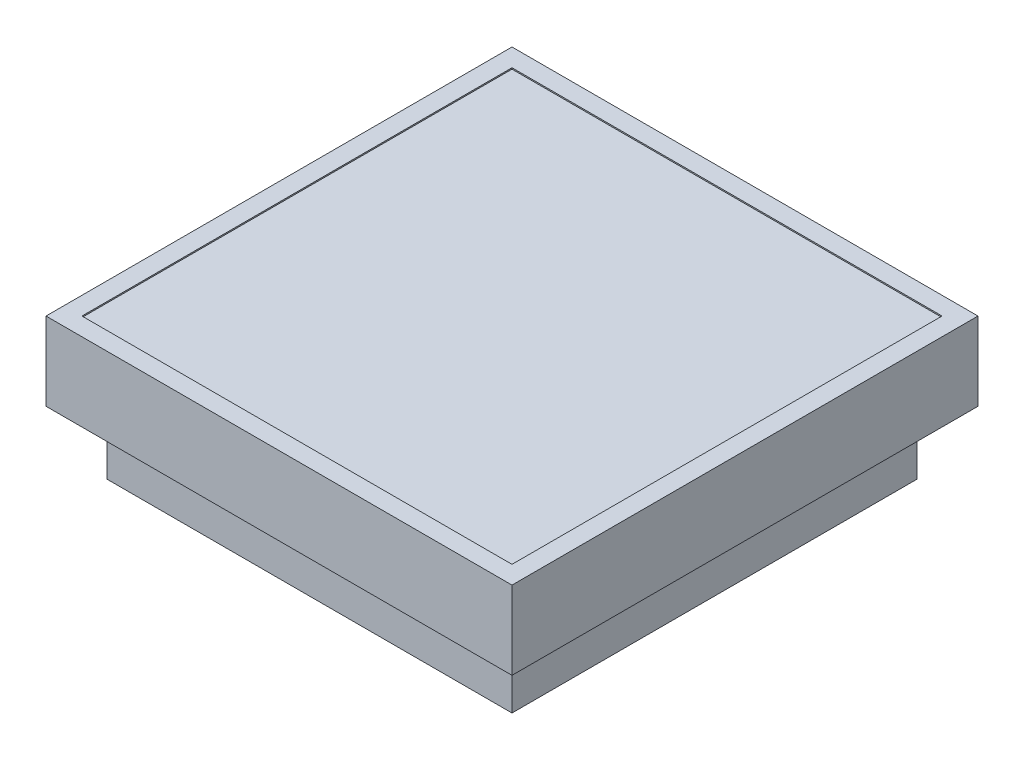
from build123d import *

# Parameters (mm, degrees)
SKETCH1_W           = 18.42
SKETCH1_H           = 18.42
BOSS_EXTRUDE1_DEPTH = 3.09
SKETCH2_W           = 16
SKETCH2_H           = 16
BOSS_EXTRUDE2_DEPTH = 2.5
SKETCH4_W           = 17
SKETCH4_H           = 17
CUT_EXTRUDE1_DEPTH  = 0.05


with BuildPart() as part:
    # Sketch1 → Boss-Extrude1 (new body)
    with BuildSketch(Plane(origin=(0, 0, 0), x_dir=(1, 0, 0), z_dir=(0, 1, 0))):
        Rectangle(SKETCH1_W, SKETCH1_H)
    extrude(amount=BOSS_EXTRUDE1_DEPTH)

    # Sketch2 → Boss-Extrude2 (add)
    with BuildSketch(Plane.XZ):
        Rectangle(SKETCH2_W, SKETCH2_H)
    extrude(amount=BOSS_EXTRUDE2_DEPTH)

    # Sketch4 → Cut-Extrude1 (cut)
    with BuildSketch(Plane(origin=(0, 3.09, 0), x_dir=(1, 0, 0), z_dir=(0, 1, 0))):
        Rectangle(SKETCH4_W, SKETCH4_H)
    extrude(amount=-CUT_EXTRUDE1_DEPTH, mode=Mode.SUBTRACT)


solid = part.part
